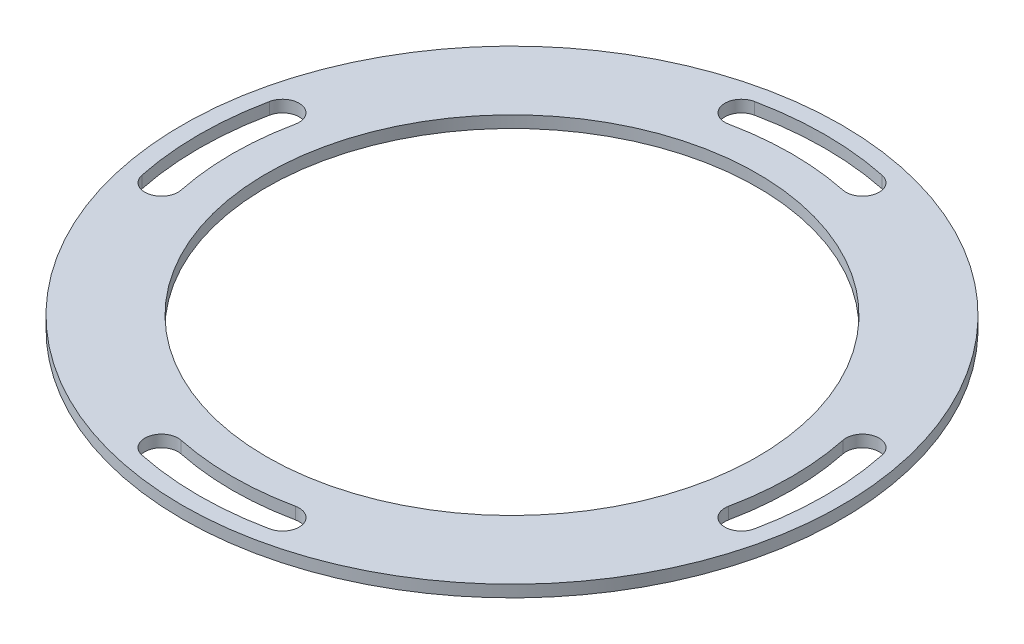
from build123d import *

# Parameters (mm, degrees)
SCHIZZO1_R                   = 139
SCHIZZO1_R_2                 = 103.5
ESTRUSIONE_ESTRUSIONE1_DEPTH = 2.5


with BuildPart() as part:
    # Schizzo1 → Estrusione-Estrusione1 (new, symmetric)
    with BuildSketch(Plane(origin=(0, 0, 0), x_dir=(1, 0, 0), z_dir=(0, 1, 0))):
        with Locations(Location((0, 0, 0), (0, 0, 270))):
            Circle(SCHIZZO1_R)
        with Locations(Location((0, 0, 0), (0, 0, 270))):
            Circle(SCHIZZO1_R_2, mode=Mode.SUBTRACT)
        with BuildLine():
            ThreePointArc((-115.468480571, 24.098722638), (-120.890722726, 32.381191474), (-129.173191562, 26.958949319))
            ThreePointArc((-129.173191562, 26.958949319), (-131.956426015, 0), (-129.173191562, -26.958949319))
            ThreePointArc((-129.173191562, -26.958949319), (-120.890722726, -32.381191474), (-115.468480571, -24.098722638))
            ThreePointArc((-115.468480571, -24.098722638), (-117.956426015, 0), (-115.468480571, 24.098722638))
        make_face(mode=Mode.SUBTRACT)
        with BuildLine():
            ThreePointArc((-24.098722638, 115.468480571), (-32.381191474, 120.890722726), (-26.958949319, 129.173191562))
            ThreePointArc((-26.958949319, 129.173191562), (0, 131.956426015), (26.958949319, 129.173191562))
            ThreePointArc((26.958949319, 129.173191562), (32.381191474, 120.890722726), (24.098722638, 115.468480571))
            ThreePointArc((24.098722638, 115.468480571), (0, 117.956426015), (-24.098722638, 115.468480571))
        make_face(mode=Mode.SUBTRACT)
        with BuildLine():
            ThreePointArc((115.468480571, 24.098722638), (120.890722726, 32.381191474), (129.173191562, 26.958949319))
            ThreePointArc((129.173191562, 26.958949319), (131.956426015, 0), (129.173191562, -26.958949319))
            ThreePointArc((129.173191562, -26.958949319), (120.890722726, -32.381191474), (115.468480571, -24.098722638))
            ThreePointArc((115.468480571, -24.098722638), (117.956426015, 0), (115.468480571, 24.098722638))
        make_face(mode=Mode.SUBTRACT)
        with BuildLine():
            ThreePointArc((24.098722638, -115.468480571), (32.381191474, -120.890722726), (26.958949319, -129.173191562))
            ThreePointArc((26.958949319, -129.173191562), (0, -131.956426015), (-26.958949319, -129.173191562))
            ThreePointArc((-26.958949319, -129.173191562), (-32.381191474, -120.890722726), (-24.098722638, -115.468480571))
            ThreePointArc((-24.098722638, -115.468480571), (0, -117.956426015), (24.098722638, -115.468480571))
        make_face(mode=Mode.SUBTRACT)
    extrude(amount=ESTRUSIONE_ESTRUSIONE1_DEPTH, both=True)


solid = part.part
